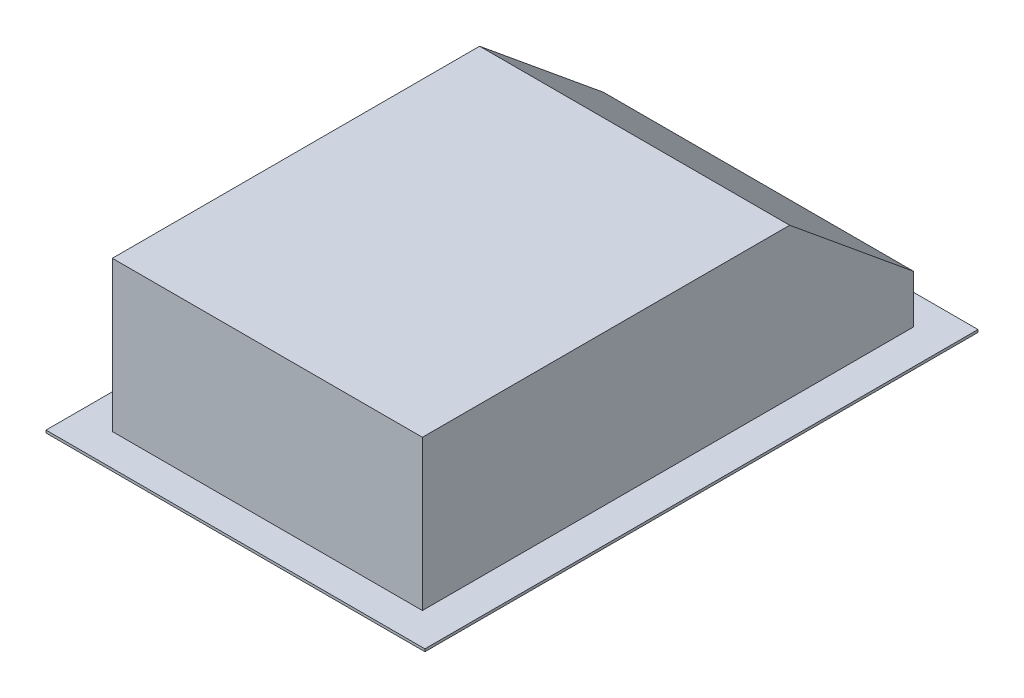
from build123d import *

# Parameters (mm, degrees)
SKETCH1_W            = 388.7
SKETCH1_H            = 435.95
SKETCH1_W_2          = 45.6
SKETCH1_H_2          = 430.25
BOSS_EXTRUDE1_DEPTH  = 189
BOSS_EXTRUDE2_START  = -433.45
SKETCH2_W            = 388.7
SKETCH2_H            = 3.2
BOSS_EXTRUDE2_DEPTH  = 430.25
CUT_EXTRUDE1_DEPTH   = 25
BOSS_EXTRUDE4_DEPTH  = 3.2
BOSS_EXTRUDE5_DEPTH  = 3.2
BOSS_EXTRUDE6_REACH  = 791.664
CUT_EXTRUDE2_REACH   = 793.231
SKETCH11_W           = 52.59
SKETCH11_H           = 168.019571709
BOSS_EXTRUDE7_DEPTH  = 3.2
BOSS_EXTRUDE8_DEPTH  = 3.2
SKETCH14_W           = 388.7
SKETCH14_H           = 3.2
BOSS_EXTRUDE9_DEPTH  = 40
SKETCH15_W           = 388.7
SKETCH15_H           = 3.2
BOSS_EXTRUDE10_DEPTH = 40
SKETCH16_W           = 693.36
SKETCH16_H           = 3.2
BOSS_EXTRUDE11_DEPTH = 43.15
SKETCH17_W           = 693.36
SKETCH17_H           = 3.2
BOSS_EXTRUDE12_DEPTH = 43.15
BOSS_EXTRUDE13_DEPTH = 388.7


with BuildPart() as part:
    # Sketch1 → Boss-Extrude1 (new body)
    with BuildSketch(Plane(origin=(0, 0, 0), x_dir=(1, 0, 0), z_dir=(0, 1, 0))):
        with Locations((191.15, 214.775)):
            Rectangle(SKETCH1_W, SKETCH1_H)
        with Locations((22.8, 215.125)):
            Rectangle(SKETCH1_W_2, SKETCH1_H_2, mode=Mode.SUBTRACT)
        with Locations((359.5, 215.125)):
            Rectangle(SKETCH1_W_2, SKETCH1_H_2, mode=Mode.SUBTRACT)
        with Locations((70.9, 215.125)):
            Rectangle(SKETCH1_W_2, SKETCH1_H_2, mode=Mode.SUBTRACT)
        with Locations((119, 215.125)):
            Rectangle(SKETCH1_W_2, SKETCH1_H_2, mode=Mode.SUBTRACT)
        with Locations((167.1, 215.125)):
            Rectangle(SKETCH1_W_2, SKETCH1_H_2, mode=Mode.SUBTRACT)
        with Locations((215.2, 215.125)):
            Rectangle(SKETCH1_W_2, SKETCH1_H_2, mode=Mode.SUBTRACT)
        with Locations((263.3, 215.125)):
            Rectangle(SKETCH1_W_2, SKETCH1_H_2, mode=Mode.SUBTRACT)
        with Locations((311.4, 215.125)):
            Rectangle(SKETCH1_W_2, SKETCH1_H_2, mode=Mode.SUBTRACT)
    extrude(amount=BOSS_EXTRUDE1_DEPTH)

    # Sketch2 → Boss-Extrude2 (add)
    with BuildSketch(Plane.XY.offset(3.2).offset(BOSS_EXTRUDE2_START)):
        with Locations((191.15, 1.6)):
            Rectangle(SKETCH2_W, SKETCH2_H)
    extrude(amount=BOSS_EXTRUDE2_DEPTH)

    # Sketch3 → Cut-Extrude1 (cut)
    with BuildSketch(Plane(origin=(0, 189, 0), x_dir=(1, 0, 0), z_dir=(0, 1, 0))):
        Polygon((0, 430.25), (0, 432.75), (382.3, 432.75), (382.3, 430.25), (336.7, 430.25), (336.7, 0), (334.2, 0), (334.2, 430.25), (288.6, 430.25), (288.6, 0), (286.1, 0), (286.1, 430.25), (240.5, 430.25), (240.5, 0), (238, 0), (238, 430.25), (192.4, 430.25), (192.4, 0), (189.9, 0), (189.9, 430.25), (144.3, 430.25), (144.3, 0), (141.8, 0), (141.8, 430.25), (96.2, 430.25), (96.2, 0), (93.7, 0), (93.7, 430.25), (48.1, 430.25), (48.1, 0), (45.6, 0), (45.6, 430.25), align=None)
    extrude(amount=-CUT_EXTRUDE1_DEPTH, mode=Mode.SUBTRACT)

    # Sketch4 → Boss-Extrude4 (add)
    with BuildSketch(Plane(origin=(385.5, 0, 0), x_dir=(0, 0, -1), z_dir=(1, 0, 0))):
        Polygon((432.75, 189), (662.75, 0), (432.75, 0), align=None)
    extrude(amount=-BOSS_EXTRUDE4_DEPTH)

    # Sketch7 → Boss-Extrude5 (add)
    with BuildSketch(Plane.ZY.offset(3.2)):
        Polygon((-432.75, 164), (-432.75, 189), (-662.75, 0), (-432.75, 0), align=None)
    extrude(amount=-BOSS_EXTRUDE5_DEPTH)

    # Sketch9 → Boss-Extrude6 (add, up to next)
    with BuildSketch(Plane(origin=(0, 0, 0), x_dir=(0, 0, -1), z_dir=(1, 0, 0)), mode=Mode.PRIVATE) as boss_extrude6_sk1:
        Polygon((662.75, 0), (658.855820106, 3.2), (432.75, 3.2), (432.75, 0), align=None)
    boss_extrude6_tool1 = extrude(boss_extrude6_sk1.sketch, amount=BOSS_EXTRUDE6_REACH, mode=Mode.PRIVATE) - part.part
    add(boss_extrude6_tool1.solids().sort_by_distance((0, 1.595446, -546.779226))[0])

    # Sketch11 → Cut-Extrude2 (cut, up to next)
    with BuildSketch(Plane(origin=(385.5, 0, 0), x_dir=(0, 0, -1), z_dir=(1, 0, 0)), mode=Mode.PRIVATE) as cut_extrude2_sk1:
        with Locations((636.455, 84.009785855)):
            Rectangle(SKETCH11_W, SKETCH11_H)
    cut_extrude2_tool1 = extrude(cut_extrude2_sk1.sketch, amount=-CUT_EXTRUDE2_REACH, mode=Mode.PRIVATE) & part.part
    add(cut_extrude2_tool1.solids().sort_by_distance((385.5, 84.009786, -636.455))[0], mode=Mode.SUBTRACT)

    # Sketch12 → Boss-Extrude7 (add)
    with BuildSketch(Plane(origin=(385.5, 0, 0), x_dir=(0, 0, -1), z_dir=(1, 0, 0))):
        Polygon((456.376412276, 189), (610.16, 62.630008348), (610.16, 43.21526087), (432.75, 189), align=None)
    extrude(amount=-BOSS_EXTRUDE7_DEPTH)

    # Sketch13 → Boss-Extrude8 (add)
    with BuildSketch(Plane.ZY.offset(3.2)):
        Polygon((-610.16, 62.630008348), (-610.16, 43.21526087), (-432.75, 189), (-456.376412276, 189), align=None)
    extrude(amount=-BOSS_EXTRUDE8_DEPTH)

    # Sketch14 → Boss-Extrude9 (add)
    with BuildSketch(Plane(origin=(0, 0, -610.16), x_dir=(-1, 0, 0), z_dir=(0, 0, -1))):
        with Locations((-191.15, 1.6)):
            Rectangle(SKETCH14_W, SKETCH14_H)
    extrude(amount=BOSS_EXTRUDE9_DEPTH)

    # Sketch15 → Boss-Extrude10 (add)
    with BuildSketch(Plane.XY.offset(3.2)):
        with Locations((191.15, 1.6)):
            Rectangle(SKETCH15_W, SKETCH15_H)
    extrude(amount=BOSS_EXTRUDE10_DEPTH)

    # Sketch16 → Boss-Extrude11 (add)
    with BuildSketch(Plane(origin=(385.5, 0, 0), x_dir=(0, 0, -1), z_dir=(1, 0, 0))):
        with Locations((303.48, 1.6)):
            Rectangle(SKETCH16_W, SKETCH16_H)
    extrude(amount=BOSS_EXTRUDE11_DEPTH)

    # Sketch17 → Boss-Extrude12 (add)
    with BuildSketch(Plane.ZY.offset(3.2)):
        with Locations((-303.48, 1.6)):
            Rectangle(SKETCH17_W, SKETCH17_H)
    extrude(amount=BOSS_EXTRUDE12_DEPTH)

    # Sketch18 → Boss-Extrude13 (add)
    with BuildSketch(Plane.ZY.offset(3.2)):
        Polygon((-457.200187026, 191.3), (3.2, 191.3), (3.2, 189), (-456.376412276, 189), (-610.16, 62.630008348), (-610.16, 3.2), (-612.46, 3.2), (-612.46, 63.716936295), align=None)
    extrude(amount=-BOSS_EXTRUDE13_DEPTH)


solid = part.part
